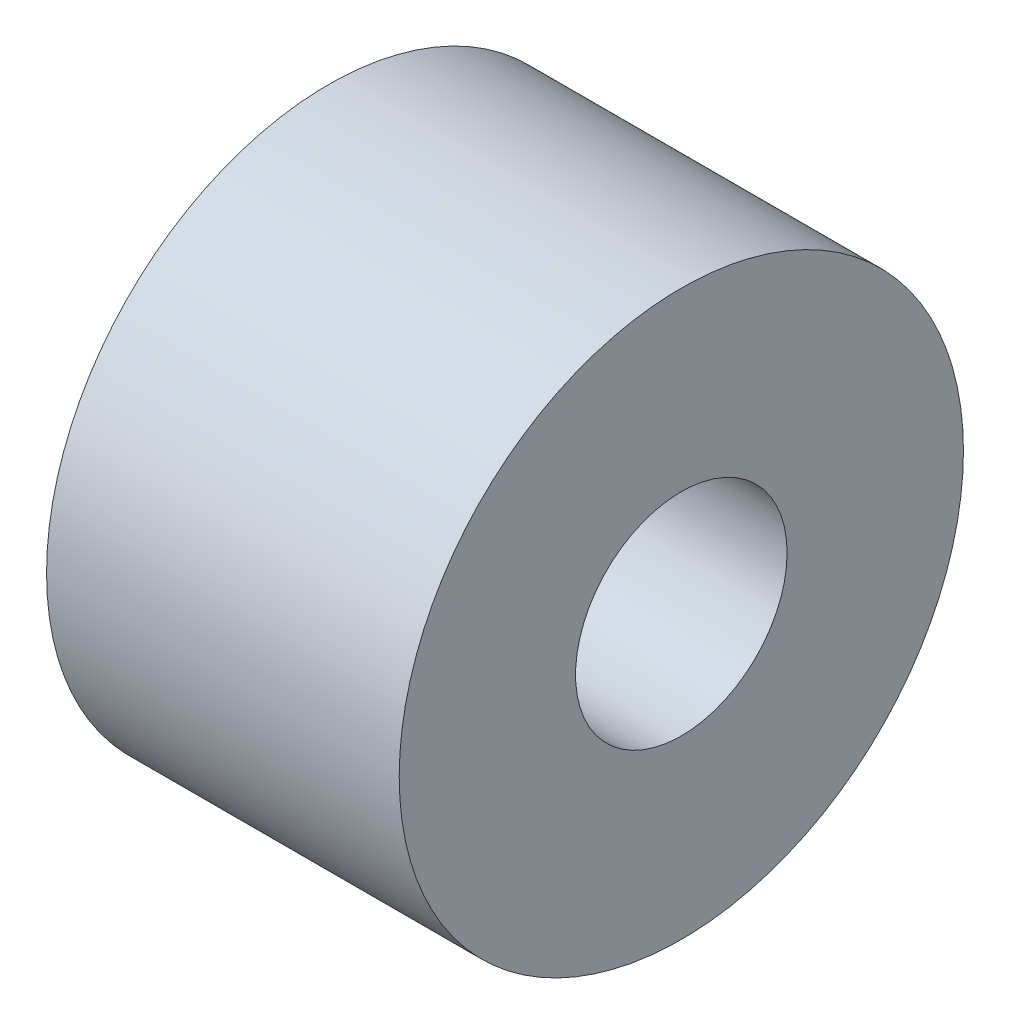
from build123d import *

# Parameters (mm, degrees)
SKETCH1_R           = 20
SKETCH1_R_2         = 7.5
BOSS_EXTRUDE1_DEPTH = 25


with BuildPart() as part:
    # Sketch1 → Boss-Extrude1 (new body)
    with BuildSketch(Plane(origin=(0, 0, 0), x_dir=(0, 0, -1), z_dir=(1, 0, 0))):
        Circle(SKETCH1_R)
        Circle(SKETCH1_R_2, mode=Mode.SUBTRACT)
    extrude(amount=BOSS_EXTRUDE1_DEPTH)


solid = part.part
